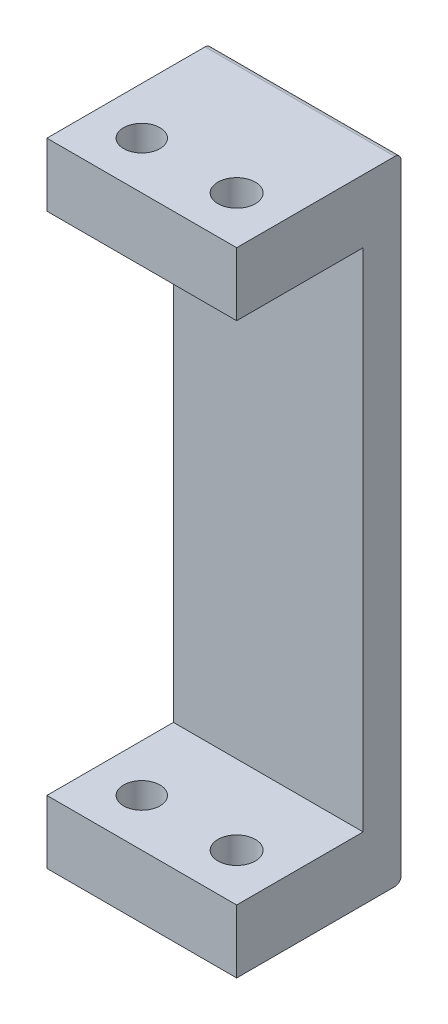
from build123d import *

# Parameters (mm, degrees)
SKETCH1_W           = 150
SKETCH1_H           = 500
BOSS_EXTRUDE1_DEPTH = 30
SKETCH2_W           = 100
SKETCH2_H           = 50
BOSS_EXTRUDE2_DEPTH = 150
SKETCH3_W           = 100
SKETCH3_H           = 50
BOSS_EXTRUDE3_DEPTH = 150
FILLET1_R           = 5
SKETCH4_R           = 14.383133374
SKETCH4_R_2         = 14.814559663
CUT_EXTRUDE1_DEPTH  = 538.959106253


with BuildPart() as part:
    # Sketch1 → Boss-Extrude1 (new body)
    with BuildSketch(Plane.XY):
        with Locations((75, 250)):
            Rectangle(SKETCH1_W, SKETCH1_H)
    extrude(amount=BOSS_EXTRUDE1_DEPTH)

    # Sketch2 → Boss-Extrude2 (add)
    with BuildSketch(Plane.ZY):
        with Locations((80, 475)):
            Rectangle(SKETCH2_W, SKETCH2_H)
    extrude(amount=-BOSS_EXTRUDE2_DEPTH)

    # Sketch3 → Boss-Extrude3 (add)
    with BuildSketch(Plane.ZY):
        with Locations((80, 25)):
            Rectangle(SKETCH3_W, SKETCH3_H)
    extrude(amount=-BOSS_EXTRUDE3_DEPTH)

    # Fillet1
    fillet1_edges = [part.edges().sort_by_distance(p)[0] for p in [
        (75, 500, 0),
        (75, 0, 0),
    ]]
    fillet(fillet1_edges, radius=FILLET1_R)

    # Sketch4 → Cut-Extrude1 (cut, through all)
    with BuildSketch(Plane(origin=(0, 500, 0), x_dir=(1, 0, 0), z_dir=(0, 1, 0))):
        with Locations(Location((37.5, -92.5, 0), (0, 0, 270))):
            Circle(SKETCH4_R)
        with Locations(Location((112.5, -92.5, 0), (0, 0, 270))):
            Circle(SKETCH4_R_2)
    extrude(amount=-CUT_EXTRUDE1_DEPTH, mode=Mode.SUBTRACT)


solid = part.part
